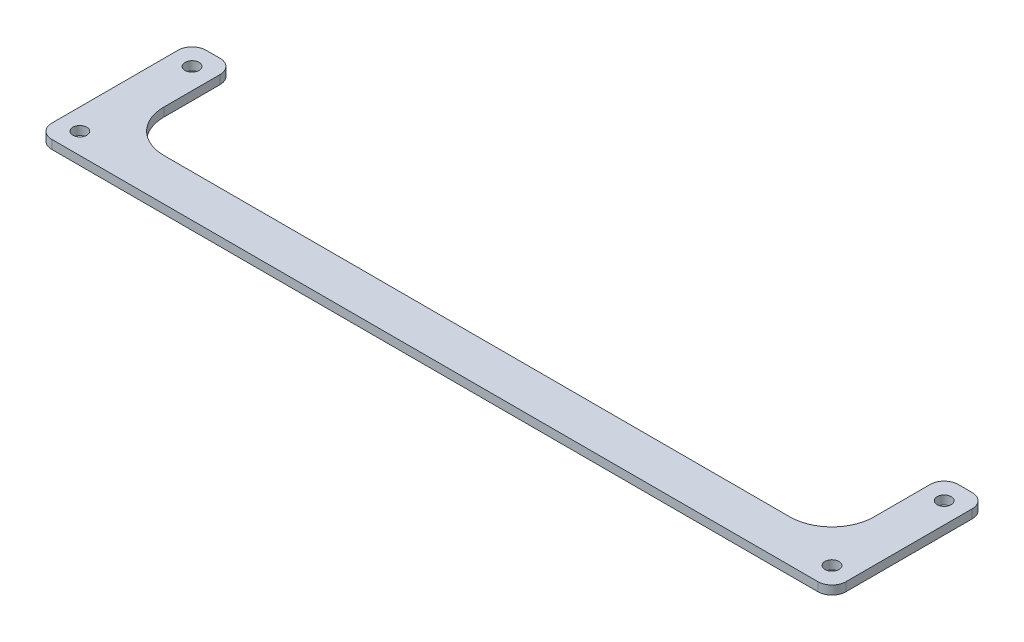
from build123d import *

# Parameters (mm, degrees)
SKETCH1_R           = 2
BOSS_EXTRUDE1_DEPTH = 2.5
FILLET1_R           = 4
FILLET3_R           = 12


with BuildPart() as part:
    # Sketch1 → Boss-Extrude1 (new body)
    with BuildSketch(Plane(origin=(0, 0, 0), x_dir=(1, 0, 0), z_dir=(0, 1, 0))):
        Polygon((-14.798836476, 8.869056619), (-26.798836476, 8.869056619), (-26.798836476, -35.130943381), (199.665714924, -35.130943381), (199.665714924, 8.869056619), (187.665714924, 8.869056619), (187.665714924, -23.130943381), (-14.798836476, -23.130943381), align=None)
        with Locations(Location((-20.798836476, 2.869056619, 0), (0, 0, 270))):
            Circle(SKETCH1_R, mode=Mode.SUBTRACT)
        with Locations(Location((-20.798836476, -29.130943381, 0), (0, 0, 270))):
            Circle(SKETCH1_R, mode=Mode.SUBTRACT)
        with Locations(Location((193.665714924, 2.869056619, 0), (0, 0, 270))):
            Circle(SKETCH1_R, mode=Mode.SUBTRACT)
        with Locations(Location((193.665714924, -29.130943381, 0), (0, 0, 270))):
            Circle(SKETCH1_R, mode=Mode.SUBTRACT)
    extrude(amount=BOSS_EXTRUDE1_DEPTH)

    # Fillet1
    fillet1_edges = [part.edges().sort_by_distance(p)[0] for p in [
        (-26.798836476, 1.25, -8.869056619),
        (-14.798836476, 1.25, -8.869056619),
        (187.665714924, 1.25, -8.869056619),
        (199.665714924, 1.25, -8.869056619),
        (199.665714924, 1.25, 35.130943381),
        (-26.798836476, 1.25, 35.130943381),
    ]]
    fillet(fillet1_edges, radius=FILLET1_R)

    # Fillet3
    fillet3_edges = [part.edges().sort_by_distance(p)[0] for p in [
        (-14.798836476, 1.25, 23.130943381),
        (187.665714924, 1.25, 23.130943381),
    ]]
    fillet(fillet3_edges, radius=FILLET3_R)


solid = part.part
